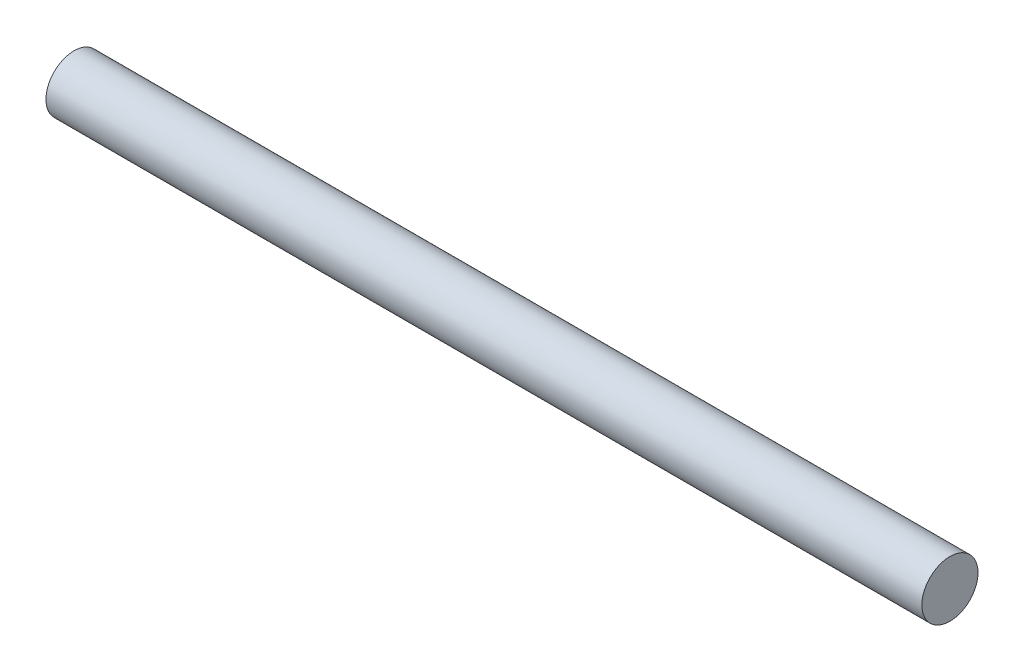
from build123d import *

# Parameters (mm, degrees)
SKETCH1_R           = 6.35
BOSS_EXTRUDE1_DEPTH = 198.12


with BuildPart() as part:
    # Sketch1 → Boss-Extrude1 (new body)
    with BuildSketch(Plane(origin=(0, 0, 0), x_dir=(0, 0, -1), z_dir=(1, 0, 0))):
        Circle(SKETCH1_R)
    extrude(amount=BOSS_EXTRUDE1_DEPTH)


solid = part.part
